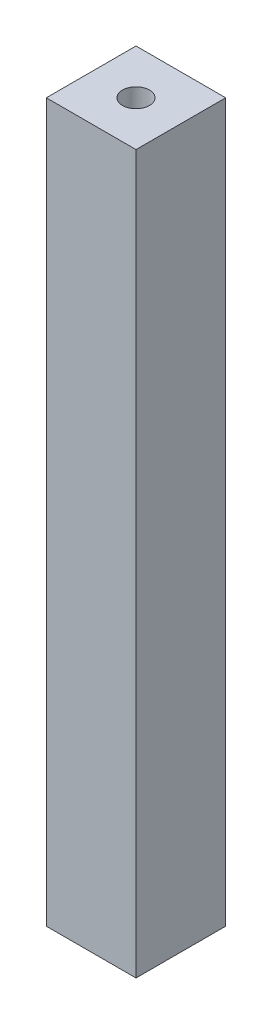
from build123d import *

# Parameters (mm, degrees)
SKETCH_1_W          = 10
SKETCH_1_H          = 10
EXTRUDE_1_DEPTH     = 80
SKETCH_2_R          = 1.5
CUT_EXTRUDE_2_DEPTH = 81.311892021


with BuildPart() as part:
    # ｽｹｯﾁ1 → ﾎﾞｽ - 押し出し1 (new body)
    with BuildSketch(Plane(origin=(0, 0, 0), x_dir=(1, 0, 0), z_dir=(0, 1, 0))):
        Rectangle(SKETCH_1_W, SKETCH_1_H)
    extrude(amount=EXTRUDE_1_DEPTH)

    # ｽｹｯﾁ2 → ｶｯﾄ - 押し出し2 (cut, through all)
    with BuildSketch(Plane(origin=(0, 0, 0), x_dir=(1, 0, 0), z_dir=(0, 1, 0))):
        with Locations(Location((0, 0, 0), (0, 0, 270))):
            Circle(SKETCH_2_R)
    extrude(amount=CUT_EXTRUDE_2_DEPTH, mode=Mode.SUBTRACT)


solid = part.part
